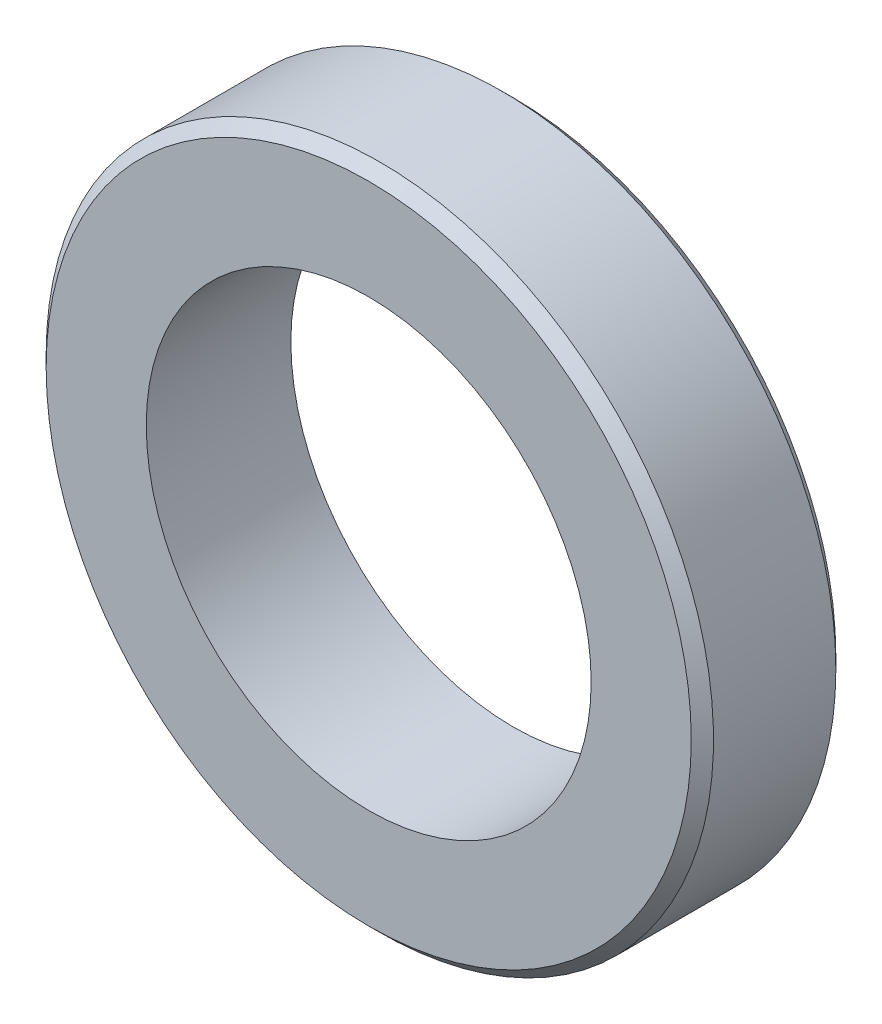
from build123d import *

# Parameters (mm, degrees)
SKETCH_1_R      = 30
SKETCH_1_R_2    = 20
EXTRUDE_1_DEPTH = 13
CHAMFER_1_SIZE  = 1


with BuildPart() as part:
    # 草图1 → 凸台-拉伸1 (new body)
    with BuildSketch(Plane.XY):
        with Locations(Location((0, 0, 0), (0, 0, 180))):
            Circle(SKETCH_1_R)
        with Locations(Location((0, 0, 0), (0, 0, 180))):
            Circle(SKETCH_1_R_2, mode=Mode.SUBTRACT)
    extrude(amount=EXTRUDE_1_DEPTH)

    # 倒角1
    chamfer_1_edges = [part.edges().sort_by_distance(p)[0] for p in [
        (30, 0, 0),
        (30, 0, 13),
    ]]
    chamfer(chamfer_1_edges, length=CHAMFER_1_SIZE)


solid = part.part
